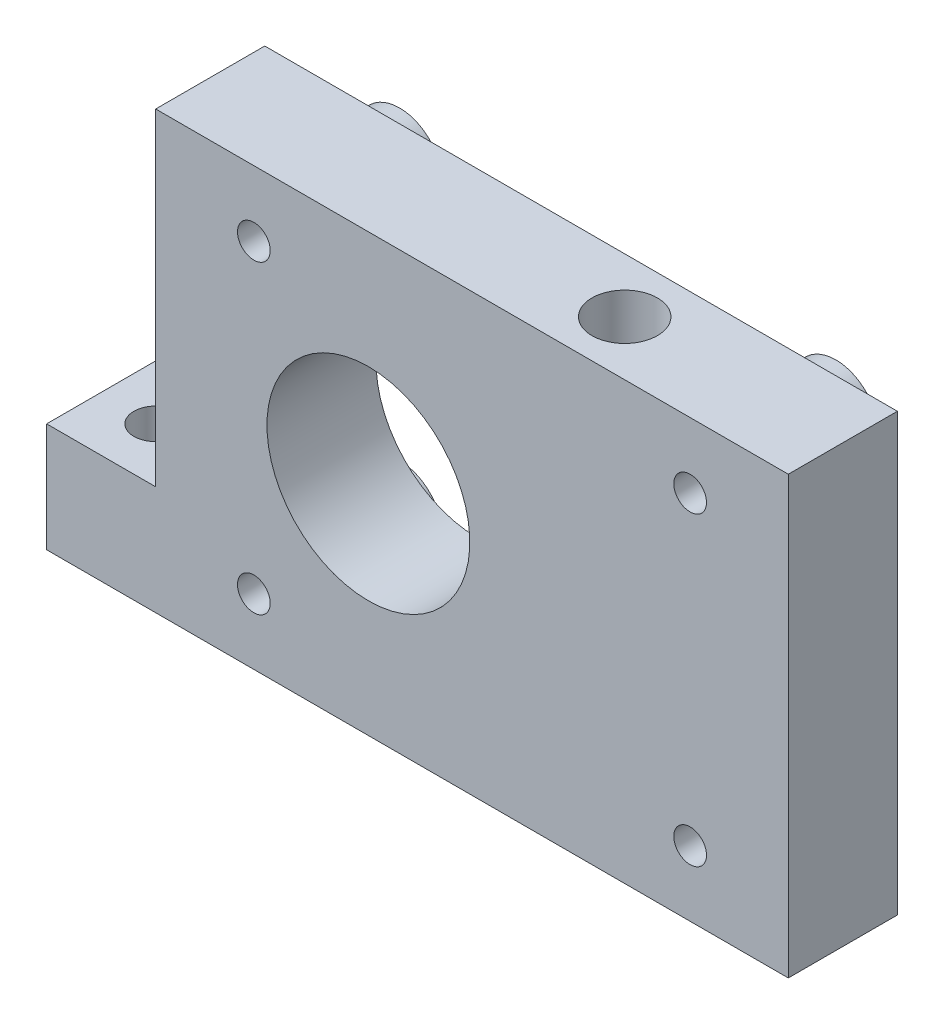
from build123d import *

# Parameters (mm, degrees)
SKETCH1_R             = 3.9
SKETCH1_R_2           = 1.5
BOSS_EXTRUDE1_DEPTH   = 13.361552014
BOSS_EXTRUDE1_2_DEPTH = 13.361552014
BOSS_EXTRUDE1_3_DEPTH = 13.361552014
BOSS_EXTRUDE1_4_DEPTH = 13.361552014
BOSS_EXTRUDE2_START   = 5.161552
SKETCH2_R             = 3.9
SKETCH2_R_2           = 9.3
BOSS_EXTRUDE2_DEPTH   = 10
CUT_EXTRUDE1_DEPTH    = 25
CUT_EXTRUDE2_DEPTH    = 72.711443105
SKETCH5_W             = 10
SKETCH5_H             = 10
SKETCH5_R             = 2
BOSS_EXTRUDE3_DEPTH   = 10


with BuildPart() as part:
    # Sketch1 → Boss-Extrude1 (new body)
    with BuildSketch(Plane.XY):
        with Locations(Location((-49, 7.83595021, 0), (0, 0, 90))):
            Circle(SKETCH1_R)
        with Locations(Location((-49, 7.83595021, 0), (0, 0, 90))):
            Circle(SKETCH1_R_2, mode=Mode.SUBTRACT)
    extrude(amount=BOSS_EXTRUDE1_DEPTH)



with BuildPart() as body_2:
    # Sketch1 → Boss-Extrude1 2 (new body)
    with BuildSketch(Plane.XY):
        with Locations(Location((-49, 35.83595021, 0), (0, 0, 90))):
            Circle(SKETCH1_R)
        with Locations(Location((-49, 35.83595021, 0), (0, 0, 90))):
            Circle(SKETCH1_R_2, mode=Mode.SUBTRACT)
    extrude(amount=BOSS_EXTRUDE1_2_DEPTH)


with BuildPart() as body_3:
    # Sketch1 → Boss-Extrude1 3 (new body)
    with BuildSketch(Plane.XY):
        with Locations(Location((-9, 35.83595021, 0), (0, 0, 90))):
            Circle(SKETCH1_R)
        with Locations(Location((-9, 35.83595021, 0), (0, 0, 90))):
            Circle(SKETCH1_R_2, mode=Mode.SUBTRACT)
    extrude(amount=BOSS_EXTRUDE1_3_DEPTH)


with BuildPart() as body_4:
    # Sketch1 → Boss-Extrude1 4 (new body)
    with BuildSketch(Plane.XY):
        with Locations(Location((-9, 7.83595021, 0), (0, 0, 90))):
            Circle(SKETCH1_R)
        with Locations(Location((-9, 7.83595021, 0), (0, 0, 90))):
            Circle(SKETCH1_R_2, mode=Mode.SUBTRACT)
    extrude(amount=BOSS_EXTRUDE1_4_DEPTH)


with BuildPart() as part_1:
    add(part.part)

    add(body_2.part)  # Boss-Extrude2 merges body 2

    add(body_3.part)  # Boss-Extrude2 merges body 3

    add(body_4.part)  # Boss-Extrude2 merges body 4
    # Sketch2 → Boss-Extrude2 (add)
    with BuildSketch(Plane.XY.offset(-1.8).offset(BOSS_EXTRUDE2_START)):
        Polygon((-58, 1.83595021), (0, 1.83595021), (0, 5.290014366), (0, 38.441339865), (0, 41.83595021), (-58, 41.83595021), align=None)
        with Locations(Location((-9, 35.83595021, 0), (0, 0, 90))):
            Circle(SKETCH2_R, mode=Mode.SUBTRACT)
        with Locations(Location((-49, 7.83595021, 0), (0, 0, 270))):
            Circle(SKETCH2_R, mode=Mode.SUBTRACT)
        with Locations(Location((-38.5, 21.83595021, 0), (0, 0, 90))):
            Circle(SKETCH2_R_2, mode=Mode.SUBTRACT)
        with Locations(Location((-49, 35.83595021, 0), (0, 0, 90))):
            Circle(SKETCH2_R, mode=Mode.SUBTRACT)
        with Locations(Location((-9, 7.83595021, 0), (0, 0, 90))):
            Circle(SKETCH2_R, mode=Mode.SUBTRACT)
    extrude(amount=BOSS_EXTRUDE2_DEPTH)

    # Sketch4 → Cut-Extrude1 (cut)
    with BuildSketch(Plane(origin=(0, 41.83595021, 0), x_dir=(1, 0, 0), z_dir=(0, 1, 0))):
        with BuildLine():
            ThreePointArc((-23, -8.361552014), (-20, -11.361552014), (-17, -8.361552014))
            Line((-17, -8.361552014), (-18, -8.361552014))
            ThreePointArc((-18, -8.361552014), (-20, -10.361552014), (-22, -8.361552014))
            Line((-22, -8.361552014), (-23, -8.361552014))
        make_face()
        with BuildLine():
            Line((-18, -8.361552014), (-17, -8.361552014))
            ThreePointArc((-17, -8.361552014), (-20, -5.361552014), (-23, -8.361552014))
            Line((-23, -8.361552014), (-22, -8.361552014))
            ThreePointArc((-22, -8.361552014), (-20, -6.361552014), (-18, -8.361552014))
        make_face()
        with BuildLine():
            ThreePointArc((-22, -8.361552014), (-20, -10.361552014), (-18, -8.361552014))
            Line((-18, -8.361552014), (-22, -8.361552014))
        make_face()
        with BuildLine():
            Line((-22, -8.361552014), (-18, -8.361552014))
            ThreePointArc((-18, -8.361552014), (-20, -6.361552014), (-22, -8.361552014))
        make_face()
    extrude(amount=-CUT_EXTRUDE1_DEPTH, mode=Mode.SUBTRACT)

    # Sketch4<3> → Cut-Extrude2 (cut, through all)
    with BuildSketch(Plane(origin=(0, 41.83595021, 0), x_dir=(1, 0, 0), z_dir=(0, 1, 0))):
        with BuildLine():
            ThreePointArc((-22, -8.361552014), (-20, -10.361552014), (-18, -8.361552014))
            Line((-18, -8.361552014), (-22, -8.361552014))
        make_face()
        with BuildLine():
            Line((-22, -8.361552014), (-18, -8.361552014))
            ThreePointArc((-18, -8.361552014), (-20, -6.361552014), (-22, -8.361552014))
        make_face()
    extrude(amount=-CUT_EXTRUDE2_DEPTH, mode=Mode.SUBTRACT)

    # Sketch5 → Boss-Extrude3 (add)
    with BuildSketch(Plane(origin=(0, 1.83595021, 0), x_dir=(1, 0, 0), z_dir=(0, 1, 0))):
        with Locations((-63, -8.361552014)):
            Rectangle(SKETCH5_W, SKETCH5_H)
        with Locations(Location((-63, -8.361552014, 0), (0, 0, 180))):
            Circle(SKETCH5_R, mode=Mode.SUBTRACT)
    extrude(amount=BOSS_EXTRUDE3_DEPTH)


solid = part_1.part
